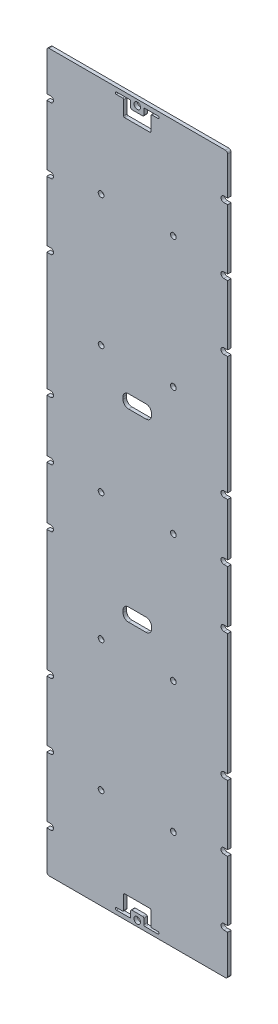
from build123d import *

# Parameters (mm, degrees)
SKETCH1_W            = 82.8
SKETCH1_H            = 327.3
PCB_EXTRUDE_DEPTH    = 1.6
SKETCH2_W            = 82.8
SKETCH2_H            = 327.3
SKETCH2_W_2          = 82.5
SKETCH2_H_2          = 327
OFFSET_EDGES_DEPTH   = 10
CORNER_FILLETS_R     = 1
SKETCH3_R            = 1.5
SKETCH3_W            = 13
SKETCH3_H            = 6
SOLAR_HOLE_DEPTH     = 169.630876473
FILLET1_R            = 2.5
SOLAR_HOLE_FILLET_R  = 0.5
M2_CLEARANCE_HOLE1_D = 2.6
SKETCH9_W            = 1.75
SKETCH9_H            = 2.6
CUT_EXTRUDE1_DEPTH   = 169.630876473


with BuildPart() as part:
    # Sketch1 → PCB extrude (new body)
    with BuildSketch(Plane.XY):
        Rectangle(SKETCH1_W, SKETCH1_H)
    extrude(amount=PCB_EXTRUDE_DEPTH)

    # Sketch2 → offset edges (cut)
    with BuildSketch(Plane.XY):
        Rectangle(SKETCH2_W, SKETCH2_H)
        Rectangle(SKETCH2_W_2, SKETCH2_H_2, mode=Mode.SUBTRACT)
    extrude(amount=OFFSET_EDGES_DEPTH, mode=Mode.SUBTRACT)

    # corner fillets
    corner_fillets_edges = [part.edges().sort_by_distance(p)[0] for p in [
        (41.25, 163.5, 0.8),
        (-41.25, 163.5, 0.8),
        (-41.25, -163.5, 0.8),
        (41.25, -163.5, 0.8),
    ]]
    fillet(corner_fillets_edges, radius=CORNER_FILLETS_R)

    # Sketch3 → Solar hole (cut, symmetric)
    with BuildSketch(Plane.XY):
        with Locations((0, 160.95)):
            Circle(SKETCH3_R)
        with BuildLine():
            Line((-2.999999999, 158.15), (2.999999999, 158.15))
            Line((2.999999999, 158.15), (2.999999999, 161.65))
            Line((2.999999999, 161.65), (9.5, 161.65))
            ThreePointArc((9.5, 161.65), (10, 161.15), (9.5, 160.65))
            Line((9.5, 160.65), (6.2, 160.65))
            Line((6.2, 160.65), (6.2, 153.35))
            Line((6.2, 153.35), (-6.2, 153.35))
            Line((-6.2, 153.35), (-6.2, 160.65))
            Line((-6.2, 160.65), (-9.5, 160.65))
            ThreePointArc((-9.5, 160.65), (-10, 161.15), (-9.5, 161.65))
            Line((-9.5, 161.65), (-2.999999999, 161.65))
            Line((-2.999999999, 161.65), (-2.999999999, 158.15))
        make_face()
        with Locations((0, 42.125)):
            Rectangle(SKETCH3_W, SKETCH3_H)
    solar_hole = extrude(amount=SOLAR_HOLE_DEPTH, both=True, mode=Mode.SUBTRACT)

    # Solar hole mirror: Solar hole across plane
    add(solar_hole.mirror(Plane.ZX), mode=Mode.SUBTRACT)

    # Fillet1
    fillet1_edges = [part.edges().sort_by_distance(p)[0] for p in [
        (-6.5, -39.125, 0.8),
        (-6.5, -45.125, 0.8),
        (6.5, -45.125, 0.8),
        (6.5, -39.125, 0.8),
        (-6.5, 45.125, 0.8),
        (-6.5, 39.125, 0.8),
        (6.5, 39.125, 0.8),
        (6.5, 45.125, 0.8),
    ]]
    fillet(fillet1_edges, radius=FILLET1_R)

    # Solar Hole Fillet
    solar_hole_fillet_edges = [part.edges().sort_by_distance(p)[0] for p in [
        (2.999999999, 161.65, 0.8),
        (2.999999999, 158.15, 0.8),
        (-2.999999999, 158.15, 0.8),
        (-2.999999999, 161.65, 0.8),
        (-6.2, 160.65, 0.8),
        (-6.2, 153.35, 0.8),
        (6.2, 153.35, 0.8),
        (6.2, 160.65, 0.8),
        (6.2, -160.65, 0.8),
        (6.2, -153.35, 0.8),
        (-6.2, -153.35, 0.8),
        (-6.2, -160.65, 0.8),
        (-2.999999999, -161.65, 0.8),
        (-2.999999999, -158.15, 0.8),
        (2.999999999, -158.15, 0.8),
        (2.999999999, -161.65, 0.8),
    ]]
    fillet(solar_hole_fillet_edges, radius=SOLAR_HOLE_FILLET_R)

    # M2 Clearance Hole1 (through all)
    with Locations(Plane.XY.offset(1.6)):
        with Locations((-39.5, 143.75), (-39.5, 113.75), (-39.5, 83.75), (-39.5, 27.25), (-39.5, 0.75), (-39.5, -25.75), (-39.5, -83.75), (-39.5, -113.75), (-39.5, -143.75), (-16.5, -117.75), (16.5, -117.75), (39.5, -143.75), (39.5, -113.75), (39.5, -83.75), (16.5, -58.1), (-16.5, -58.1), (39.5, -25.75), (39.5, 0.75), (16.5, 0), (-16.5, 0), (39.5, 27.25), (16.5, 58.1), (-16.5, 58.1), (16.5, 117.75), (-16.5, 117.75), (39.5, 83.75), (39.5, 113.75), (39.5, 143.75)):
            Hole(M2_CLEARANCE_HOLE1_D / 2)

    # Sketch9 → Cut-Extrude1 (cut, through all)
    with BuildSketch(Plane.XY):
        with Locations((-40.375, 143.75)):
            Rectangle(SKETCH9_W, SKETCH9_H)
        with Locations((40.375, 143.75)):
            Rectangle(SKETCH9_W, SKETCH9_H)
        with Locations((40.375, 113.75)):
            Rectangle(SKETCH9_W, SKETCH9_H)
        with Locations((40.375, 83.75)):
            Rectangle(SKETCH9_W, SKETCH9_H)
        with Locations((-40.375, 113.75)):
            Rectangle(SKETCH9_W, SKETCH9_H)
        with Locations((-40.375, 83.75)):
            Rectangle(SKETCH9_W, SKETCH9_H)
        with Locations((40.375, 27.25)):
            Rectangle(SKETCH9_W, SKETCH9_H)
        with Locations((-40.375, 27.25)):
            Rectangle(SKETCH9_W, SKETCH9_H)
        with Locations((40.375, 0.75)):
            Rectangle(SKETCH9_W, SKETCH9_H)
        with Locations((-40.375, 0.75)):
            Rectangle(SKETCH9_W, SKETCH9_H)
        with Locations((40.375, -25.75)):
            Rectangle(SKETCH9_W, SKETCH9_H)
        with Locations((-40.375, -25.75)):
            Rectangle(SKETCH9_W, SKETCH9_H)
        with Locations((40.375, -83.75)):
            Rectangle(SKETCH9_W, SKETCH9_H)
        with Locations((-40.375, -83.75)):
            Rectangle(SKETCH9_W, SKETCH9_H)
        with Locations((40.375, -113.75)):
            Rectangle(SKETCH9_W, SKETCH9_H)
        with Locations((-40.375, -113.75)):
            Rectangle(SKETCH9_W, SKETCH9_H)
        with Locations((40.375, -143.75)):
            Rectangle(SKETCH9_W, SKETCH9_H)
        with Locations((-40.375, -143.75)):
            Rectangle(SKETCH9_W, SKETCH9_H)
    extrude(amount=CUT_EXTRUDE1_DEPTH, mode=Mode.SUBTRACT)


solid = part.part
